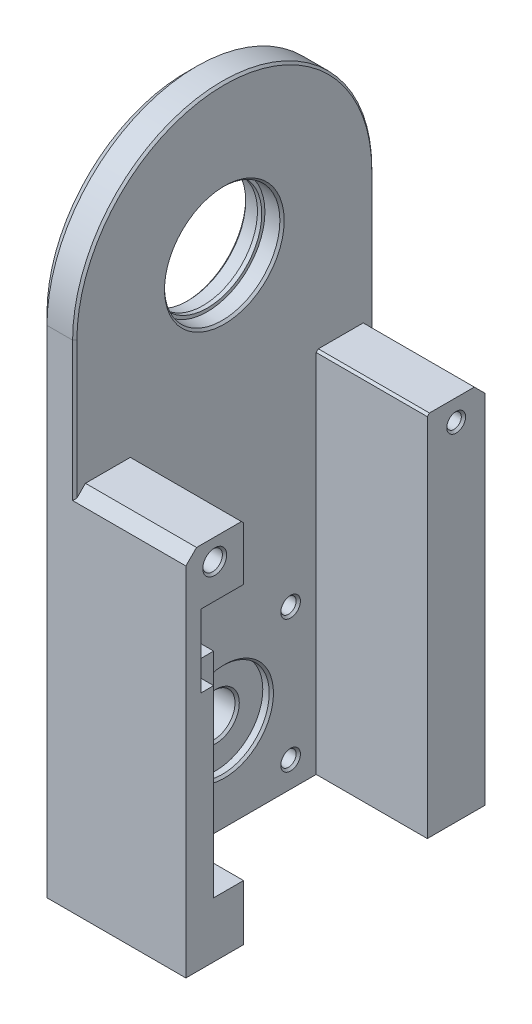
from build123d import *

# Parameters (mm, degrees)
SKETCH2_W                                           = 70
SKETCH2_H                                           = 86
BOSS_EXTRUDE1_DEPTH                                 = 35
CUT_EXTRUDE1_DEPTH                                  = 26
SKETCH2_3_R                                         = 12.75
BOSS_EXTRUDE2_DEPTH                                 = 9
SKETCH3_3_R                                         = 11
SKETCH3_3_R_2                                       = 5
CUT_EXTRUDE2_DEPTH                                  = 28
SKETCH3_4_R                                         = 5
CUT_EXTRUDE3_DEPTH                                  = 171.076453397
SKETCH15_R                                          = 13.5
CUT_EXTRUDE4_DEPTH                                  = 4
CBORE_FOR_M3_HEX_SOCKET_HEAD_CAP_SCREW1_D           = 3.6
CBORE_FOR_M3_HEX_SOCKET_HEAD_CAP_SCREW1_CBORE_D     = 6.5
CBORE_FOR_M3_HEX_SOCKET_HEAD_CAP_SCREW1_CBORE_DEPTH = 3.4
F_4_6_4_6_DIAMETER_HOLE1_D                          = 4.6
F_4_6_4_6_DIAMETER_HOLE1_DEPTH                      = 6
F_4_6_4_6_DIAMETER_HOLE1_TIP                        = 1.381979424
CBORE_FOR_M3_HEX_SOCKET_HEAD_CAP_SCREW2_D           = 3.4
CBORE_FOR_M3_HEX_SOCKET_HEAD_CAP_SCREW2_CBORE_D     = 6.5
CBORE_FOR_M3_HEX_SOCKET_HEAD_CAP_SCREW2_CBORE_DEPTH = 3.4
F_4_6_4_6_DIAMETER_HOLE2_D                          = 4.6
F_4_6_4_6_DIAMETER_HOLE2_DEPTH                      = 6
F_4_6_4_6_DIAMETER_HOLE2_TIP                        = 1.381979424
F_4_6_4_6_DIAMETER_HOLE3_D                          = 4.6
F_4_6_4_6_DIAMETER_HOLE3_DEPTH                      = 5
F_4_6_4_6_DIAMETER_HOLE3_TIP                        = 1.381979424
SKETCH19_W                                          = 7
SKETCH19_H                                          = 43
CUT_EXTRUDE5_DEPTH                                  = 7
F_2_5MM_CHAMFER1_SIZE                               = 2.5
F_0_5MM_CHAMFER2_SIZE                               = 0.5


with BuildPart() as part:
    # Sketch2 → Boss-Extrude1 (new body)
    with BuildSketch(Plane(origin=(0, 0, 0), x_dir=(0, 0, -1), z_dir=(1, 0, 0))):
        with Locations((35, 43)):
            Rectangle(SKETCH2_W, SKETCH2_H)
    extrude(amount=BOSS_EXTRUDE1_DEPTH)

    # Sketch3 → Cut-Extrude1 (cut)
    with BuildSketch(Plane(origin=(35, 0, 0), x_dir=(0, 0, -1), z_dir=(1, 0, 0))):
        Polygon((13.5, 0), (56.5, 0), (56.5, 86), (13.5, 86), (13.5, 73), (3.5, 73), (3.5, 56), (13.5, 56), align=None)
    extrude(amount=-CUT_EXTRUDE1_DEPTH, mode=Mode.SUBTRACT)

    # Sketch2<3> → Boss-Extrude2 (add)
    with BuildSketch(Plane(origin=(0, 0, 0), x_dir=(0, 0, -1), z_dir=(1, 0, 0))):
        with BuildLine():
            Line((0, 116), (0, 86))
            Line((0, 86), (70, 86))
            Line((70, 86), (70, 116))
            ThreePointArc((70, 116), (35, 151), (0, 116))
        make_face()
        with Locations((35, 116)):
            Circle(SKETCH2_3_R, mode=Mode.SUBTRACT)
    extrude(amount=BOSS_EXTRUDE2_DEPTH)

    # Sketch3<3> → Cut-Extrude2 (cut)
    # profile 1 of 2: a face of its own
    with BuildSketch(Plane(origin=(35, 0, 0), x_dir=(0, 0, -1), z_dir=(1, 0, 0))):
        with Locations((35, 21.5)):
            Circle(SKETCH3_3_R)
        with Locations((35, 21.5)):
            Circle(SKETCH3_3_R_2, mode=Mode.SUBTRACT)
    # profile 2 of 2: a face of its own
    with BuildSketch(Plane(origin=(35, 0, 0), x_dir=(0, 0, -1), z_dir=(1, 0, 0))):
        with Locations((35, 21.5)):
            Circle(SKETCH3_3_R_2)
    extrude(amount=-CUT_EXTRUDE2_DEPTH, mode=Mode.SUBTRACT)

    # Sketch3<4> → Cut-Extrude3 (cut, through all)
    with BuildSketch(Plane(origin=(35, 0, 0), x_dir=(0, 0, -1), z_dir=(1, 0, 0))):
        with Locations((35, 21.5)):
            Circle(SKETCH3_4_R)
    extrude(amount=-CUT_EXTRUDE3_DEPTH, mode=Mode.SUBTRACT)

    # Sketch15 → Cut-Extrude4 (cut)
    with BuildSketch(Plane(origin=(9, 0, 0), x_dir=(0, 0, -1), z_dir=(1, 0, 0))):
        with Locations((35, 116)):
            Circle(SKETCH15_R)
    cut_extrude4 = extrude(amount=-CUT_EXTRUDE4_DEPTH, mode=Mode.SUBTRACT)

    # Mirror1: Cut-Extrude4 across plane
    add(cut_extrude4.mirror(Plane(origin=(4.5, 0, 0), x_dir=(0, 0, 1), z_dir=(1, 0, 0))), mode=Mode.SUBTRACT)

    # CBORE for M3 Hex Socket Head Cap Screw1 (through all)
    with Locations(Plane.ZY):
        with Locations((-19.5, 6), (-35, 21.5), (-19.5, 37), (-50.5, 6), (-50.5, 37)):
            CounterBoreHole(CBORE_FOR_M3_HEX_SOCKET_HEAD_CAP_SCREW1_D / 2, CBORE_FOR_M3_HEX_SOCKET_HEAD_CAP_SCREW1_CBORE_D / 2, CBORE_FOR_M3_HEX_SOCKET_HEAD_CAP_SCREW1_CBORE_DEPTH)

    # Ø4.6 (4.6) Diameter Hole1
    with Locations(Plane(origin=(0, 0, 0), x_dir=(-1, 0, 0), z_dir=(0, -1, 0))):
        with Locations((-4.5, 35), (-35, 35), (-4.5, 63.5), (-4.5, 6.5)):
            Hole(F_4_6_4_6_DIAMETER_HOLE1_D / 2, depth=F_4_6_4_6_DIAMETER_HOLE1_DEPTH)
            with Locations((0, 0, -(F_4_6_4_6_DIAMETER_HOLE1_DEPTH + F_4_6_4_6_DIAMETER_HOLE1_TIP / 2))):  # 118° drill point
                Cone(0, F_4_6_4_6_DIAMETER_HOLE1_D / 2, F_4_6_4_6_DIAMETER_HOLE1_TIP, mode=Mode.SUBTRACT)

    # CBORE for M3 Hex Socket Head Cap Screw2 (through all)
    with Locations(Plane.ZY):
        with Locations((-63.25, 81)):
            CounterBoreHole(CBORE_FOR_M3_HEX_SOCKET_HEAD_CAP_SCREW2_D / 2, CBORE_FOR_M3_HEX_SOCKET_HEAD_CAP_SCREW2_CBORE_D / 2, CBORE_FOR_M3_HEX_SOCKET_HEAD_CAP_SCREW2_CBORE_DEPTH)

    # Ø4.6 (4.6) Diameter Hole2
    with Locations(Plane(origin=(35, 0, 0), x_dir=(0, 0, -1), z_dir=(1, 0, 0))):
        with Locations((6.75, 81)):
            Hole(F_4_6_4_6_DIAMETER_HOLE2_D / 2, depth=F_4_6_4_6_DIAMETER_HOLE2_DEPTH)
            with Locations((0, 0, -(F_4_6_4_6_DIAMETER_HOLE2_DEPTH + F_4_6_4_6_DIAMETER_HOLE2_TIP / 2))):  # 118° drill point
                Cone(0, F_4_6_4_6_DIAMETER_HOLE2_D / 2, F_4_6_4_6_DIAMETER_HOLE2_TIP, mode=Mode.SUBTRACT)

    # Ø4.6 (4.6) Diameter Hole3
    with Locations(Plane.ZY):
        with Locations((-60, 68.75), (-10, 68.75)):
            Hole(F_4_6_4_6_DIAMETER_HOLE3_D / 2, depth=F_4_6_4_6_DIAMETER_HOLE3_DEPTH)
            with Locations((0, 0, -(F_4_6_4_6_DIAMETER_HOLE3_DEPTH + F_4_6_4_6_DIAMETER_HOLE3_TIP / 2))):  # 118° drill point
                Cone(0, F_4_6_4_6_DIAMETER_HOLE3_D / 2, F_4_6_4_6_DIAMETER_HOLE3_TIP, mode=Mode.SUBTRACT)

    # Sketch19 → Cut-Extrude5 (cut)
    with BuildSketch(Plane(origin=(0, 0, -13.5), x_dir=(-1, 0, 0), z_dir=(0, 0, -1))):
        with Locations((-31.5, 34.5)):
            Rectangle(SKETCH19_W, SKETCH19_H)
    extrude(amount=-CUT_EXTRUDE5_DEPTH, mode=Mode.SUBTRACT)

    # 2,5mm Chamfer1
    f_2_5mm_chamfer1_edges = [part.edges().sort_by_distance(p)[0] for p in [
        (0, 151, -35),
        (0, 58, 0),
        (0, 58, -70),
        (22, 86, 0),
        (22, 86, -70),
    ]]
    chamfer(f_2_5mm_chamfer1_edges, length=F_2_5MM_CHAMFER1_SIZE)

    # 0,5mm Chamfer2
    f_0_5mm_chamfer2_edges = [part.edges().sort_by_distance(p)[0] for p in [
        (9, 6, -48.7),
        (0, 6, -53.75),
        (9, 37, -17.7),
        (0, 37, -22.75),
        (2.2, 0, -35),
        (2.2, 0, -6.5),
        (2.2, 0, -63.5),
        (0, 81, -66.5),
        (35, 81, -61.55),
        (35, 81, -9.05),
        (0, 68.75, -57.7),
        (0, 68.75, -7.7),
        (22, 86, -13.5),
        (22, 86, -56.5),
        (9, 99.75, 0),
        (9, 99.75, -70),
        (9, 151, -35),
        (9, 21.5, -24),
        (7, 21.5, -30),
        (0, 21.5, -30),
        (9, 116, -21.5),
        (0, 116, -21.5),
        (9, 6, -17.7),
        (0, 6, -22.75),
        (9, 37, -48.7),
        (0, 37, -53.75),
    ]]
    chamfer(f_0_5mm_chamfer2_edges, length=F_0_5MM_CHAMFER2_SIZE)


solid = part.part
